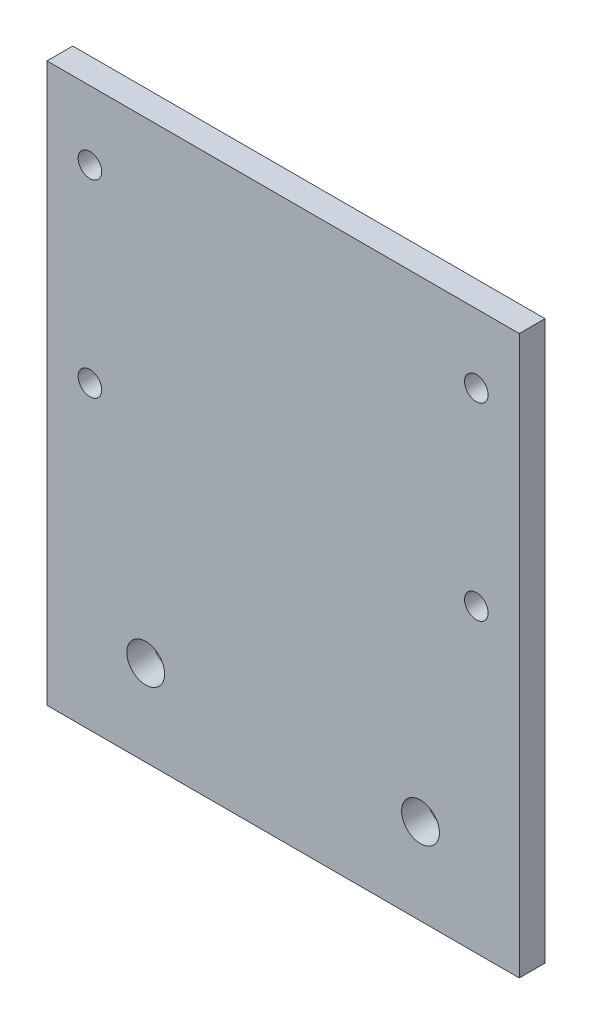
from build123d import *

# Parameters (mm, degrees)
SKETCH1_W           = 55
SKETCH1_H           = 65
SKETCH1_R           = 1.375
SKETCH1_R_2         = 2.2
BOSS_EXTRUDE1_DEPTH = 3


with BuildPart() as part:
    # Sketch1 → Boss-Extrude1 (new body)
    with BuildSketch(Plane.XY):
        with Locations((27.5, 32.5)):
            Rectangle(SKETCH1_W, SKETCH1_H)
        with Locations((5, 57)):
            Circle(SKETCH1_R, mode=Mode.SUBTRACT)
        with Locations((50, 57)):
            Circle(SKETCH1_R, mode=Mode.SUBTRACT)
        with Locations((50, 35)):
            Circle(SKETCH1_R, mode=Mode.SUBTRACT)
        with Locations((5, 35)):
            Circle(SKETCH1_R, mode=Mode.SUBTRACT)
        with Locations((11.5, 10)):
            Circle(SKETCH1_R_2, mode=Mode.SUBTRACT)
        with Locations((43.5, 10)):
            Circle(SKETCH1_R_2, mode=Mode.SUBTRACT)
    extrude(amount=BOSS_EXTRUDE1_DEPTH)


solid = part.part
